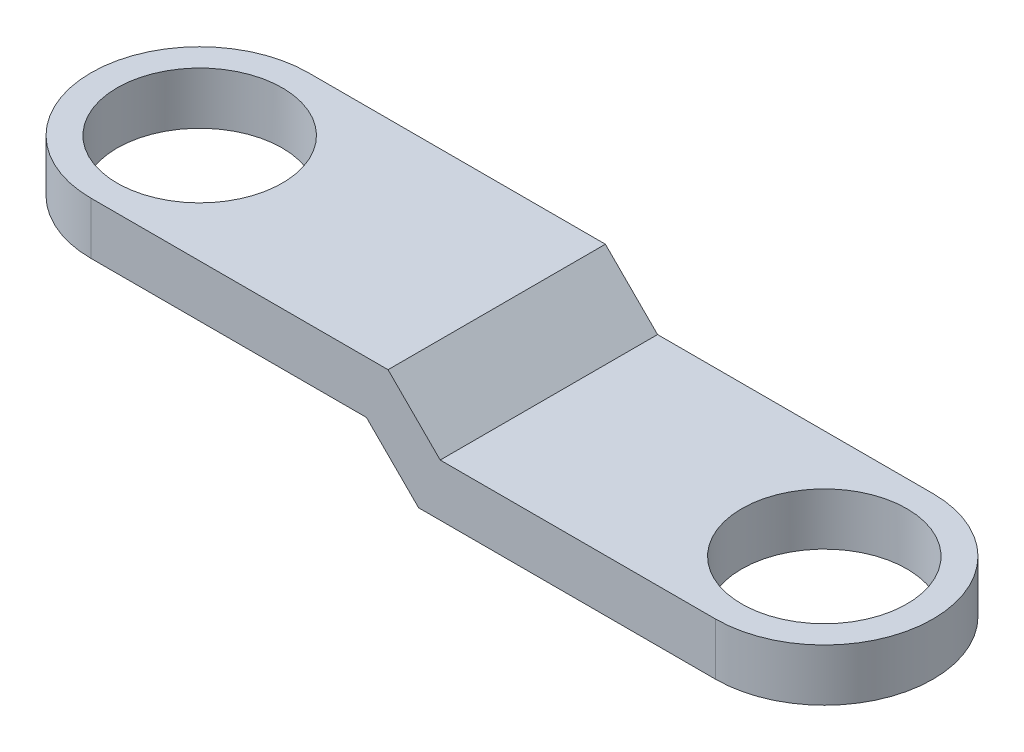
from build123d import *

# Parameters (mm, degrees)
EXTRUDE_THIN1_DEPTH = 12.5
BOSS_EXTRUDE1_DEPTH = 6
BOSS_EXTRUDE2_START = -12
BOSS_EXTRUDE2_DEPTH = 6
SKETCH4_R           = 9.5
CUT_EXTRUDE1_DEPTH  = 52.428062496


with BuildPart() as part:
    # Sketch1 → Extrude-Thin1 (new, symmetric)
    with BuildSketch(Plane.XY):
        Polygon((-35.921024484, 0), (-4.242640687, 0), (1.757359313, -6), (35.921024484, -6), (35.921024484, 0), (4.242640687, 0), (-1.757359313, 6), (-35.921024484, 6), align=None)
    extrude(amount=EXTRUDE_THIN1_DEPTH, both=True)

    # Sketch3 → Boss-Extrude1 (add)
    with BuildSketch(Plane(origin=(0, 6, 0), x_dir=(1, 0, 0), z_dir=(0, 1, 0))):
        with BuildLine():
            ThreePointArc((-35.921024484, 12.5), (-48.421024484, 0), (-35.921024484, -12.5))
            Line((-35.921024484, -12.5), (-35.921024484, 12.5))
        make_face()
    extrude(amount=-BOSS_EXTRUDE1_DEPTH)

    # Sketch3<3> → Boss-Extrude2 (add)
    with BuildSketch(Plane(origin=(0, 6, 0), x_dir=(1, 0, 0), z_dir=(0, 1, 0)).offset(BOSS_EXTRUDE2_START)):
        with BuildLine():
            Line((35.921024484, 12.5), (35.921024484, -12.5))
            ThreePointArc((35.921024484, -12.5), (48.421024484, 0), (35.921024484, 12.5))
        make_face()
    extrude(amount=BOSS_EXTRUDE2_DEPTH)

    # Sketch4 → Cut-Extrude1 (cut, through all)
    with BuildSketch(Plane(origin=(0, 6, 0), x_dir=(1, 0, 0), z_dir=(0, 1, 0))):
        with Locations(Location((-35.921024484, 0, 0), (0, 0, 180))):
            Circle(SKETCH4_R)
        with Locations(Location((35.921024484, 0, 0), (0, 0, 180))):
            Circle(SKETCH4_R)
    extrude(amount=-CUT_EXTRUDE1_DEPTH, mode=Mode.SUBTRACT)


solid = part.part
